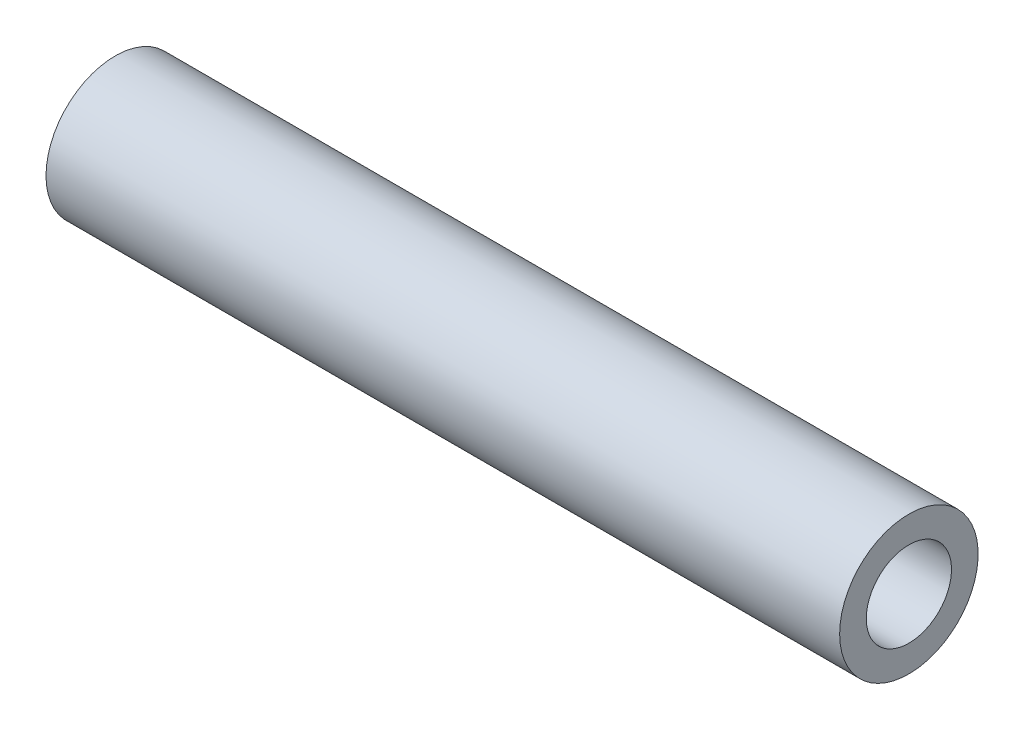
from build123d import *

# Parameters (mm, degrees)
SKETCH1_W = 149
SKETCH1_H = 5


with BuildPart() as part:
    # Sketch1 → Revolve1 (revolve)
    with BuildSketch(Plane.XY, mode=Mode.PRIVATE) as revolve1_sk:
        with Locations((0, 10.5)):
            Rectangle(SKETCH1_W, SKETCH1_H)
    revolve(revolve1_sk.sketch.rotate(Axis((-101.395540413, 0, 0), (1, 0, 0)), 90), axis=Axis((-101.395540413, 0, 0), (1, 0, 0)))


solid = part.part
